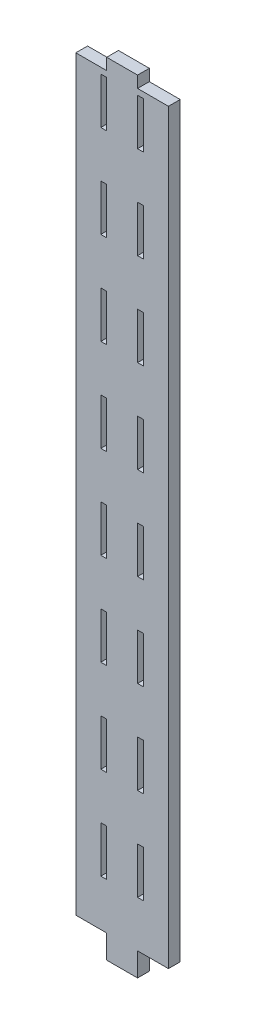
from build123d import *

# Parameters (mm, degrees)
SKETCH1_W           = 3.17
SKETCH1_H           = 25
SKETCH1_W_2         = 3.175
BOSS_EXTRUDE1_DEPTH = 6.35


with BuildPart() as part:
    # Sketch1 → Boss-Extrude1 (new body)
    with BuildSketch(Plane.XY):
        Polygon((0, 0), (0, 403.175), (16.666666667, 403.175), (16.666666667, 409.425), (33.333333333, 409.425), (33.333333333, 403.175), (50, 403.175), (50, 0), (33.333333333, 0), (33.333333333, -12.7), (16.666666667, -12.7), (16.666666667, 0), align=None)
        with Locations((34.918333333, 137.5)):
            Rectangle(SKETCH1_W, SKETCH1_H, mode=Mode.SUBTRACT)
        with Locations((34.920833333, 37.5)):
            Rectangle(SKETCH1_W_2, SKETCH1_H, mode=Mode.SUBTRACT)
        with Locations((15.079166667, 37.5)):
            Rectangle(SKETCH1_W_2, SKETCH1_H, mode=Mode.SUBTRACT)
        with Locations((34.918333333, 87.5)):
            Rectangle(SKETCH1_W, SKETCH1_H, mode=Mode.SUBTRACT)
        with Locations((15.079166667, 87.5)):
            Rectangle(SKETCH1_W_2, SKETCH1_H, mode=Mode.SUBTRACT)
        with Locations((15.079166667, 137.5)):
            Rectangle(SKETCH1_W_2, SKETCH1_H, mode=Mode.SUBTRACT)
        with Locations((34.918333333, 187.5)):
            Rectangle(SKETCH1_W, SKETCH1_H, mode=Mode.SUBTRACT)
        with Locations((15.079166667, 187.5)):
            Rectangle(SKETCH1_W_2, SKETCH1_H, mode=Mode.SUBTRACT)
        with Locations((34.918333333, 237.5)):
            Rectangle(SKETCH1_W, SKETCH1_H, mode=Mode.SUBTRACT)
        with Locations((15.079166667, 237.5)):
            Rectangle(SKETCH1_W_2, SKETCH1_H, mode=Mode.SUBTRACT)
        with Locations((34.918333333, 287.5)):
            Rectangle(SKETCH1_W, SKETCH1_H, mode=Mode.SUBTRACT)
        with Locations((15.079166667, 287.5)):
            Rectangle(SKETCH1_W_2, SKETCH1_H, mode=Mode.SUBTRACT)
        with Locations((34.918333333, 337.5)):
            Rectangle(SKETCH1_W, SKETCH1_H, mode=Mode.SUBTRACT)
        with Locations((15.079166667, 337.5)):
            Rectangle(SKETCH1_W_2, SKETCH1_H, mode=Mode.SUBTRACT)
        with Locations((34.918333333, 387.5)):
            Rectangle(SKETCH1_W, SKETCH1_H, mode=Mode.SUBTRACT)
        with Locations((15.079166667, 387.5)):
            Rectangle(SKETCH1_W_2, SKETCH1_H, mode=Mode.SUBTRACT)
    extrude(amount=BOSS_EXTRUDE1_DEPTH)


solid = part.part
